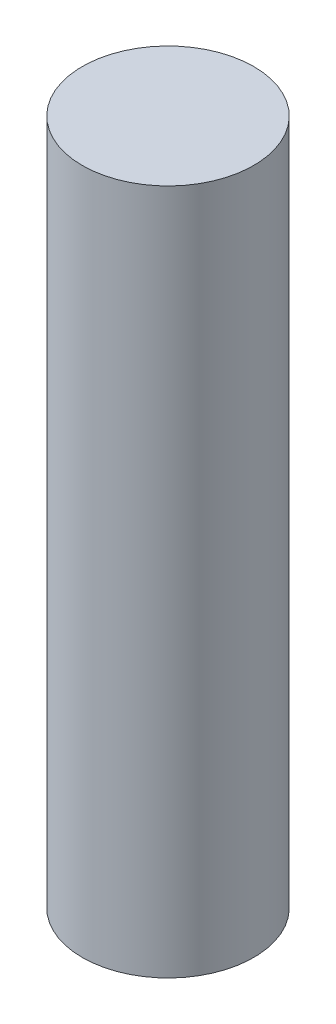
from build123d import *

# Parameters (mm, degrees)
ESQUISSE1_R        = 3
BOSS_EXTRU_1_DEPTH = 12


with BuildPart() as part:
    # Esquisse1 → Boss.-Extru.1 (new, symmetric)
    with BuildSketch(Plane(origin=(0, 0, 0), x_dir=(1, 0, 0), z_dir=(0, 1, 0))):
        with Locations(Location((0, 0, 0), (0, 0, 270))):
            Circle(ESQUISSE1_R)
    extrude(amount=BOSS_EXTRU_1_DEPTH, both=True)


solid = part.part
